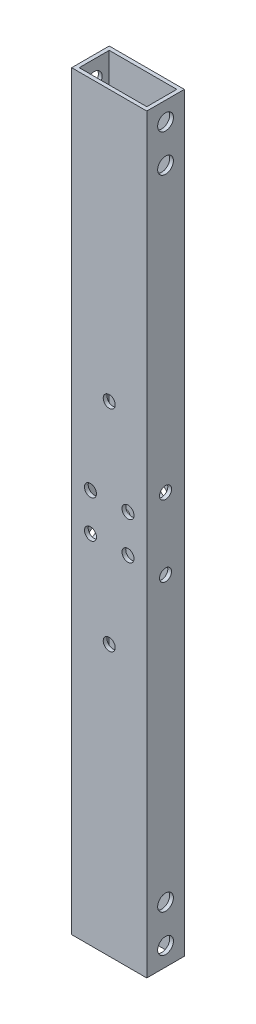
from build123d import *

# Parameters (mm, degrees)
SKETCH_1_W          = 20
SKETCH_1_H          = 10
SKETCH_1_W_2        = 18
SKETCH_1_H_2        = 8
EXTRUDE_1_DEPTH     = 200
SKETCH_3_R          = 1.6
CUT_EXTRUDE_1_DEPTH = 201.499376558
SKETCH_4_R          = 1.6
CUT_EXTRUDE_2_DEPTH = 202.059692629
SKETCH_5_R          = 1.6
CUT_EXTRUDE_3_DEPTH = 201.499376558
SKETCH_6_R          = 2.1
CUT_EXTRUDE_4_DEPTH = 202.059692629


with BuildPart() as part:
    # 草图1 → 拉伸-薄壁1 (new body)
    with BuildSketch(Plane(origin=(0, 0, 0), x_dir=(1, 0, 0), z_dir=(0, 1, 0))):
        Rectangle(SKETCH_1_W, SKETCH_1_H)
        Rectangle(SKETCH_1_W_2, SKETCH_1_H_2, mode=Mode.SUBTRACT)
    extrude(amount=EXTRUDE_1_DEPTH)

    # 草图3 → 切除-拉伸1 (cut, through all)
    with BuildSketch(Plane.XY.offset(5)):
        with Locations((0, 128)):
            Circle(SKETCH_3_R)
        with Locations(Location((0, 72, 0), (0, 0, 180))):
            Circle(SKETCH_3_R)
    extrude(amount=-CUT_EXTRUDE_1_DEPTH, mode=Mode.SUBTRACT)

    # 草图4 → 切除-拉伸2 (cut, through all)
    with BuildSketch(Plane(origin=(10, 0, 0), x_dir=(0, 0, -1), z_dir=(1, 0, 0))):
        with Locations((0, 109.5)):
            Circle(SKETCH_4_R)
        with Locations((0, 90.5)):
            Circle(SKETCH_4_R)
    extrude(amount=-CUT_EXTRUDE_2_DEPTH, mode=Mode.SUBTRACT)

    # 草图5 → 切除-拉伸3 (cut, through all)
    with BuildSketch(Plane(origin=(0, 0, -5), x_dir=(-1, 0, 0), z_dir=(0, 0, -1))):
        with Locations((-5, 105)):
            Circle(SKETCH_5_R)
        with Locations((-5, 95)):
            Circle(SKETCH_5_R)
        with Locations((5, 95)):
            Circle(SKETCH_5_R)
        with Locations((5, 105)):
            Circle(SKETCH_5_R)
    extrude(amount=-CUT_EXTRUDE_3_DEPTH, mode=Mode.SUBTRACT)

    # 草图6 → 切除-拉伸4 (cut, through all)
    with BuildSketch(Plane(origin=(10, 0, 0), x_dir=(0, 0, -1), z_dir=(1, 0, 0))):
        with Locations((0, 5)):
            Circle(SKETCH_6_R)
        with Locations((0, 15)):
            Circle(SKETCH_6_R)
        with Locations((0, 185)):
            Circle(SKETCH_6_R)
        with Locations((0, 195)):
            Circle(SKETCH_6_R)
    extrude(amount=-CUT_EXTRUDE_4_DEPTH, mode=Mode.SUBTRACT)


solid = part.part
